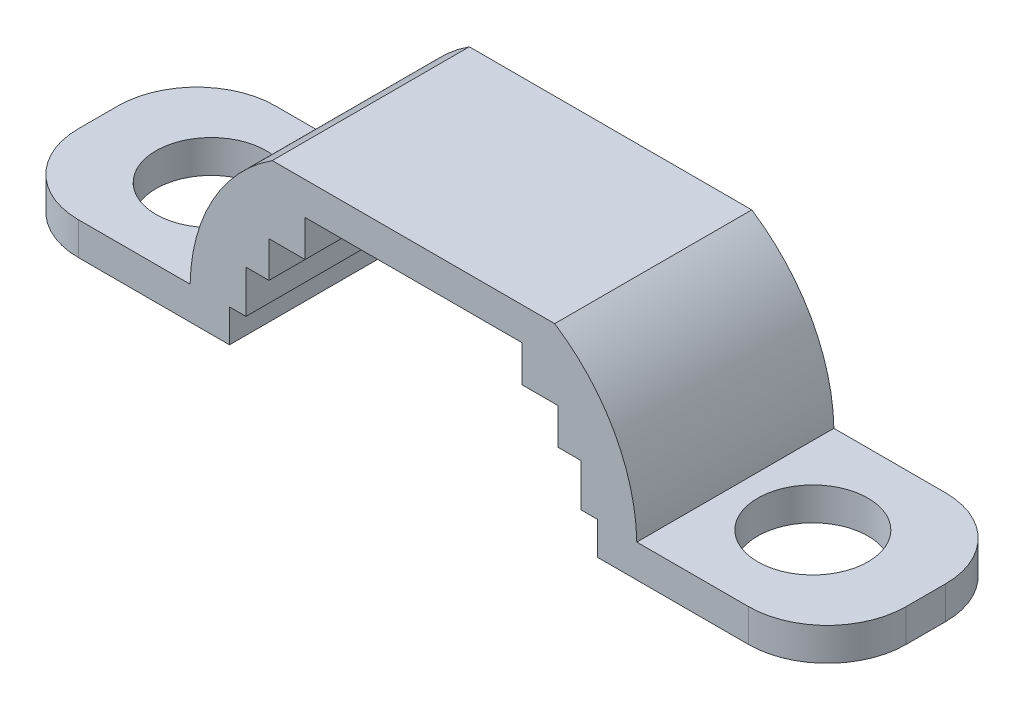
from build123d import *

# Parameters (mm, degrees)
EXTRUDE_THIN1_DEPTH  = 15
SKETCH2_R            = 8.4
CUT_EXTRUDE1_DEPTH   = 69.574794932
FILLET1_R            = 12
FILLET1_OF_MIRROR1_R = 12
BOSS_EXTRUDE1_DEPTH  = 30


with BuildPart() as part:
    # Sketch1 → Extrude-Thin1 (new, symmetric)
    with BuildSketch(Plane.XY):
        Polygon((-63, 4.5), (-28, 4.5), (-28, 9.5), (-25.5, 9.5), (-25.5, 16), (-22, 16), (-22, 21.5), (-16.5, 21.5), (-16.5, 27.05), (0, 27.05), (0, 32.05), (-21.5, 32.05), (-21.5, 26.5), (-27, 26.5), (-27, 21), (-30.5, 21), (-30.5, 14.5), (-33, 14.5), (-33, 9.5), (-63, 9.5), align=None)
    extrude_thin1 = extrude(amount=EXTRUDE_THIN1_DEPTH, both=True)

    # Sketch2 → Cut-Extrude1 (cut, through all)
    with BuildSketch(Plane(origin=(0, 9.5, 0), x_dir=(1, 0, 0), z_dir=(0, 1, 0))):
        with Locations(Location((-45.8, 0, 0), (0, 0, 270))):
            Circle(SKETCH2_R)
    cut_extrude1 = extrude(amount=-CUT_EXTRUDE1_DEPTH, mode=Mode.SUBTRACT)

    # Fillet1
    fillet1_edges = [part.edges().sort_by_distance(p)[0] for p in [
        (-63, 7, -15),
        (-63, 7, 15),
    ]]
    fillet(fillet1_edges, radius=FILLET1_R)

    # Mirror1: Extrude-Thin1, Cut-Extrude1 across plane
    add(extrude_thin1.mirror(Plane(origin=(0, 32.05, 15), x_dir=(0, 0, 1), z_dir=(1, 0, 0))))
    add(cut_extrude1.mirror(Plane(origin=(0, 32.05, 15), x_dir=(0, 0, 1), z_dir=(1, 0, 0))), mode=Mode.SUBTRACT)

    # Fillet1 of Mirror1
    fillet1_of_mirror1_edges = [part.edges().sort_by_distance(p)[0] for p in [
        (63, 7, -15),
        (63, 7, 15),
    ]]
    fillet(fillet1_of_mirror1_edges, radius=FILLET1_OF_MIRROR1_R)

    # Sketch4 → Boss-Extrude1 (add)
    with BuildSketch(Plane(origin=(0, 0, -15), x_dir=(-1, 0, 0), z_dir=(0, 0, -1))):
        with BuildLine():
            Line((-34, 9.5), (-33, 9.5))
            Line((-33, 9.5), (-33, 14.5))
            Line((-33, 14.5), (-30.5, 14.5))
            Line((-30.5, 14.5), (-30.5, 21))
            Line((-30.5, 21), (-27, 21))
            Line((-27, 21), (-27, 26.5))
            Line((-27, 26.5), (-21.5, 26.5))
            Line((-21.5, 26.5), (-21.5, 32.05))
            ThreePointArc((-21.5, 32.05), (-30.55647166, 22.330693825), (-34, 9.5))
        make_face()
    boss_extrude1 = extrude(amount=-BOSS_EXTRUDE1_DEPTH)

    # Mirror2: Boss-Extrude1 across plane
    add(boss_extrude1.mirror(Plane(origin=(0, 0, 0), x_dir=(0, 0, 1), z_dir=(1, 0, 0))))


solid = part.part
